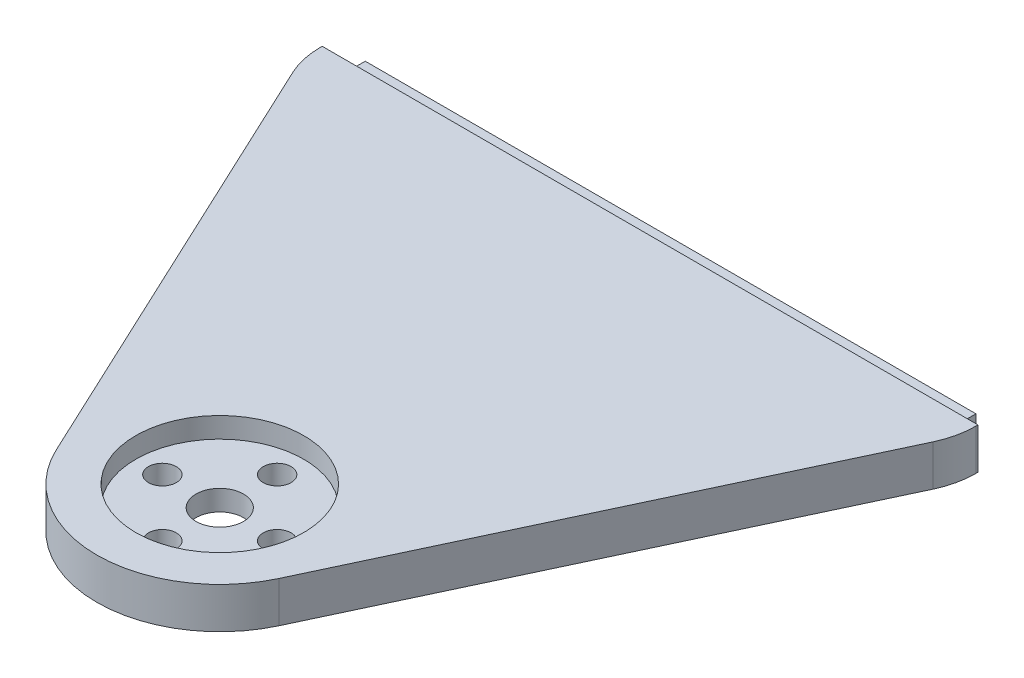
from build123d import *

# Parameters (mm, degrees)
BOSS_EXTRUDE1_DEPTH = 5
SKETCH3_W           = 80
SKETCH3_H           = 5
BOSS_EXTRUDE2_DEPTH = 5
SKETCH6_W           = 80
SKETCH6_H           = 5
SKETCH6_W_2         = 74.5
SKETCH6_H_2         = 2.1
CUT_EXTRUDE2_DEPTH  = 2.5
FILLET1_R           = 10
SKETCH7_R           = 2.9
CUT_EXTRUDE3_DEPTH  = 5
SKETCH8_R           = 1.7
CUT_EXTRUDE4_DEPTH  = 5
CIRPATTERN1_COUNT   = 4
SKETCH9_R           = 10.25
CUT_EXTRUDE5_DEPTH  = 2.5


with BuildPart() as part:
    # Sketch2 → Boss-Extrude1 (new body)
    with BuildSketch(Plane(origin=(0, 0, 0), x_dir=(1, 0, 0), z_dir=(0, 1, 0))):
        with BuildLine():
            Line((-40, 0), (40, 0))
            Line((40, 0), (13.582225242, -56.365780194))
            ThreePointArc((13.582225242, -56.365780194), (0, -65), (-13.582225242, -56.365780194))
            Line((-13.582225242, -56.365780194), (-40, 0))
        make_face()
    extrude(amount=BOSS_EXTRUDE1_DEPTH)

    # Sketch3 → Boss-Extrude2 (add)
    with BuildSketch(Plane(origin=(0, 0, 0), x_dir=(-1, 0, 0), z_dir=(0, 0, -1))):
        with Locations((0, 2.5)):
            Rectangle(SKETCH3_W, SKETCH3_H)
    extrude(amount=BOSS_EXTRUDE2_DEPTH)

    # Sketch6 → Cut-Extrude2 (cut)
    with BuildSketch(Plane(origin=(0, 0, -5), x_dir=(-1, 0, 0), z_dir=(0, 0, -1))):
        with Locations((0, 2.5)):
            Rectangle(SKETCH6_W, SKETCH6_H)
        with Locations((0, 2.5)):
            Rectangle(SKETCH6_W_2, SKETCH6_H_2, mode=Mode.SUBTRACT)
    extrude(amount=-CUT_EXTRUDE2_DEPTH, mode=Mode.SUBTRACT)

    # Fillet1
    fillet1_edges = [part.edges().sort_by_distance(p)[0] for p in [
        (-40, 2.5, 0),
        (40, 2.5, 0),
    ]]
    fillet(fillet1_edges, radius=FILLET1_R)

    # Sketch7 → Cut-Extrude3 (cut)
    with BuildSketch(Plane(origin=(0, 0, 0), x_dir=(-1, 0, 0), z_dir=(0, -1, 0))):
        with Locations(Location((0, -50, 0), (0, 0, 90))):
            Circle(SKETCH7_R)
    extrude(amount=-CUT_EXTRUDE3_DEPTH, mode=Mode.SUBTRACT)

    # Sketch8 → Cut-Extrude4 (cut)
    with BuildSketch(Plane(origin=(0, 5, 0), x_dir=(1, 0, 0), z_dir=(0, 1, 0))):
        with Locations(Location((0, -57, 0), (0, 0, 270))):
            Circle(SKETCH8_R)
    cut_extrude4 = extrude(amount=-CUT_EXTRUDE4_DEPTH, mode=Mode.SUBTRACT)

    # CirPattern1: Cut-Extrude4 ×4 about axis
    cirpattern1_axis = Axis((0, 0, 50), (0, 1, 0))
    for i in range(1, CIRPATTERN1_COUNT):
        add(cut_extrude4.rotate(cirpattern1_axis, i * 360 / CIRPATTERN1_COUNT), mode=Mode.SUBTRACT)

    # Sketch9 → Cut-Extrude5 (cut)
    with BuildSketch(Plane(origin=(0, 5, 0), x_dir=(1, 0, 0), z_dir=(0, 1, 0))):
        with Locations(Location((0, -50, 0), (0, 0, 270))):
            Circle(SKETCH9_R)
    extrude(amount=-CUT_EXTRUDE5_DEPTH, mode=Mode.SUBTRACT)


solid = part.part
